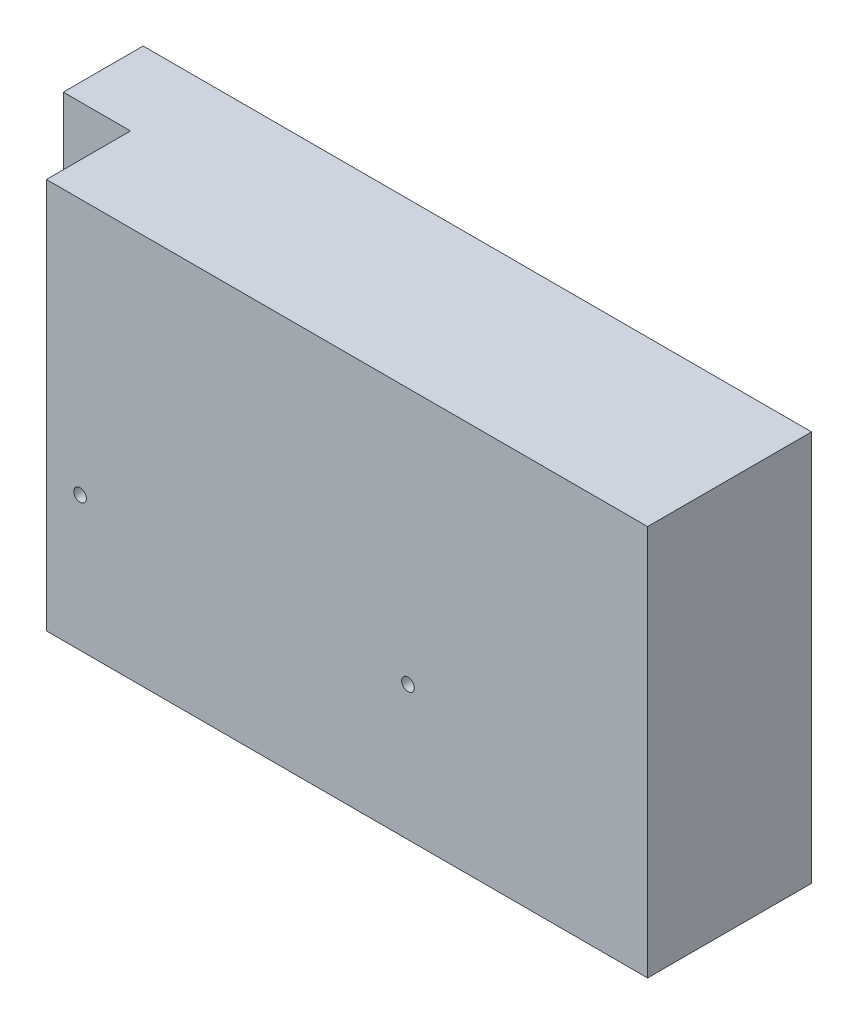
from build123d import *

# Parameters (mm, degrees)
SKETCH_1_W          = 159
SKETCH_1_H          = 93
EXTRUDE_1_DEPTH     = 39
SKETCH_2_R          = 1.5
CUT_EXTRUDE_1_DEPTH = 39
SKETCH_3_W          = 16
SKETCH_3_H          = 93
CUT_EXTRUDE_2_DEPTH = 20


with BuildPart() as part:
    # Эскиз1 → Бобышка-Вытянуть1 (new body)
    with BuildSketch(Plane.XY):
        Rectangle(SKETCH_1_W, SKETCH_1_H)
    extrude(amount=EXTRUDE_1_DEPTH)

    # Эскиз2 → Вырез-Вытянуть1 (cut)
    with BuildSketch(Plane(origin=(0, 0, 0), x_dir=(-1, 0, 0), z_dir=(0, 0, -1))):
        with Locations((-22.5, -14.5)):
            Circle(SKETCH_2_R)
        with Locations((55.5, -14.5)):
            Circle(SKETCH_2_R)
    extrude(amount=-CUT_EXTRUDE_1_DEPTH, mode=Mode.SUBTRACT)

    # Эскиз3 → Вырез-Вытянуть2 (cut)
    with BuildSketch(Plane.XY.offset(39)):
        with Locations((-71.5, 0)):
            Rectangle(SKETCH_3_W, SKETCH_3_H)
    extrude(amount=-CUT_EXTRUDE_2_DEPTH, mode=Mode.SUBTRACT)


solid = part.part
